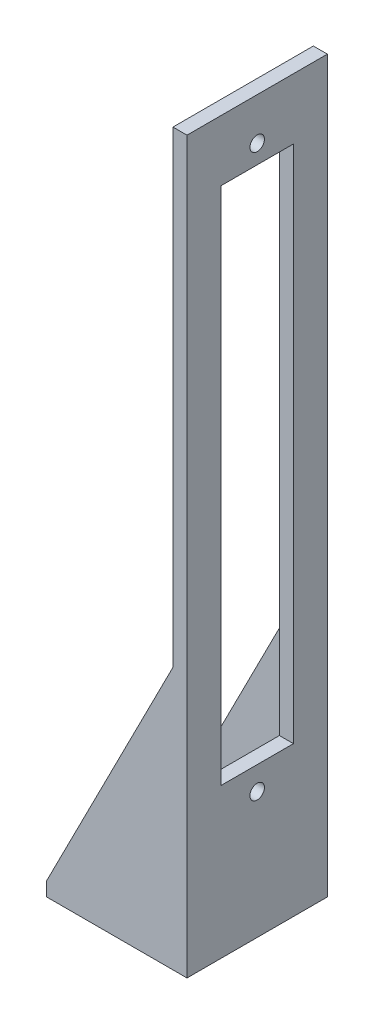
from build123d import *

# Parameters (mm, degrees)
ESBO_O1_W                = 30
ESBO_O1_H                = 30
ESBO_O1_R                = 1.55
RESSALTO_EXTRUS_O1_DEPTH = 3
ESBO_O2_W                = 3
ESBO_O2_H                = 30
RESSALTO_EXTRUS_O2_DEPTH = 153
ESBO_O3_R                = 1.55
ESBO_O3_W                = 15.5
ESBO_O3_H                = 111
CORTE_EXTRUS_O1_DEPTH    = 153
RESSALTO_EXTRUS_O3_DEPTH = 3
RESSALTO_EXTRUS_O4_DEPTH = 3


with BuildPart() as part:
    # Esboço1 → Ressalto-extrusão1 (new body)
    with BuildSketch(Plane(origin=(0, 0, 0), x_dir=(1, 0, 0), z_dir=(0, 1, 0))):
        Rectangle(ESBO_O1_W, ESBO_O1_H)
        with Locations(Location((-9, -7, 0), (0, 0, 270))):
            Circle(ESBO_O1_R, mode=Mode.SUBTRACT)
        with Locations(Location((7, 9, 0), (0, 0, 270))):
            Circle(ESBO_O1_R, mode=Mode.SUBTRACT)
    extrude(amount=RESSALTO_EXTRUS_O1_DEPTH)

    # Esboço2 → Ressalto-extrusão2 (add)
    with BuildSketch(Plane(origin=(0, 3, 0), x_dir=(1, 0, 0), z_dir=(0, 1, 0))):
        with Locations((13.5, 0)):
            Rectangle(ESBO_O2_W, ESBO_O2_H)
    extrude(amount=RESSALTO_EXTRUS_O2_DEPTH)

    # Esboço3 → Corte-extrusão1 (cut)
    with BuildSketch(Plane(origin=(15, 0, 0), x_dir=(0, 0, -1), z_dir=(1, 0, 0))):
        with Locations((0, 147)):
            Circle(ESBO_O3_R)
        with Locations((0, 27)):
            Circle(ESBO_O3_R)
        with Locations((0, 87.5)):
            Rectangle(ESBO_O3_W, ESBO_O3_H)
    extrude(amount=-CORTE_EXTRUS_O1_DEPTH, mode=Mode.SUBTRACT)

    # Esboço4 → Ressalto-extrusão3 (add)
    with BuildSketch(Plane.XY.offset(15)):
        Polygon((12, 56), (-15, 3), (12, 3), align=None)
    extrude(amount=-RESSALTO_EXTRUS_O3_DEPTH)

    # Esboço5 → Ressalto-extrusão4 (add)
    with BuildSketch(Plane(origin=(0, 0, -15), x_dir=(-1, 0, 0), z_dir=(0, 0, -1))):
        Polygon((15, 3), (-12, 56), (-12, 3), align=None)
    extrude(amount=-RESSALTO_EXTRUS_O4_DEPTH)


solid = part.part
